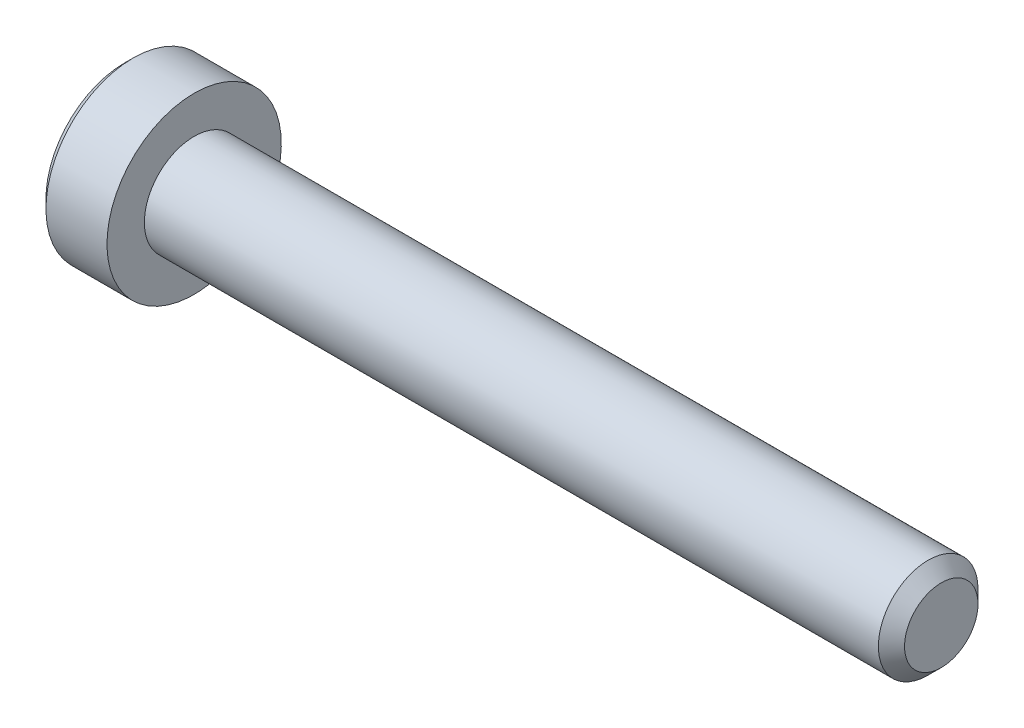
from build123d import *

# Parameters (mm, degrees)
SKETCH2_R           = 2
BOSS_EXTRUDE1_DEPTH = 14
CHAMFER1_SIZE       = 0.525
CUT_EXTRUDE1_DEPTH  = 2.42


with BuildPart() as part:
    # Sketch2 → Boss-Extrude1 (new body)
    with BuildSketch(Plane(origin=(15, 0, 0), x_dir=(0, 0, -1), z_dir=(1, 0, 0))):
        Circle(SKETCH2_R)
    extrude(amount=-BOSS_EXTRUDE1_DEPTH)

    # Chamfer1
    chamfer1_edges = [part.edges().sort_by_distance(p)[0] for p in [
        (15, 0, 2),
    ]]
    chamfer(chamfer1_edges, length=CHAMFER1_SIZE)

    # Sketch10 → Revolve2 (revolve)
    with BuildSketch(Plane.XY, mode=Mode.PRIVATE) as revolve2_sk:
        Polygon((2.154700538, 0), (1, 2), (-15, 2), (-15, 0), align=None)
    revolve(revolve2_sk.sketch.rotate(Axis((-15, 0, 0), (1, 0, 0)), 270), axis=Axis((-15, 0, 0), (1, 0, 0)))

    # Sketch6 → Revolve1 (revolve)
    with BuildSketch(Plane.XY):
        Polygon((-17.45, 3.5), (-17.8, 3.15), (-17.8, 0), (-15, 0), (-15, 3.5), align=None)
    revolve(axis=Axis((-15, 0, 0), (-1, 0, 0)))

    # Sketch4 → Cut-Extrude1 (cut)
    with BuildSketch(Plane(origin=(-17.8, 0, 0), x_dir=(0, 0, -1), z_dir=(1, 0, 0))):
        Polygon((0, 1.443375673), (-1.25, 0.721687836), (-1.25, -0.721687836), (0, -1.443375673), (1.25, -0.721687836), (1.25, 0.721687836), align=None)
    extrude(amount=CUT_EXTRUDE1_DEPTH, mode=Mode.SUBTRACT)

    # Cut-Extrude2 cone 1 section (through the dimple's axis) → Cut-Extrude2 (revolve, cut)
    with BuildSketch(Plane(origin=(-17.8, 0, 0), x_dir=(0, 0, 1), z_dir=(0, 1, 0))):
        Polygon((0, 0), (1.443375673, 0), (0, 1.443375673), align=None)
    revolve(axis=Axis((-17.8, 0, 0), (1, 0, 0)), mode=Mode.SUBTRACT)


solid = part.part
